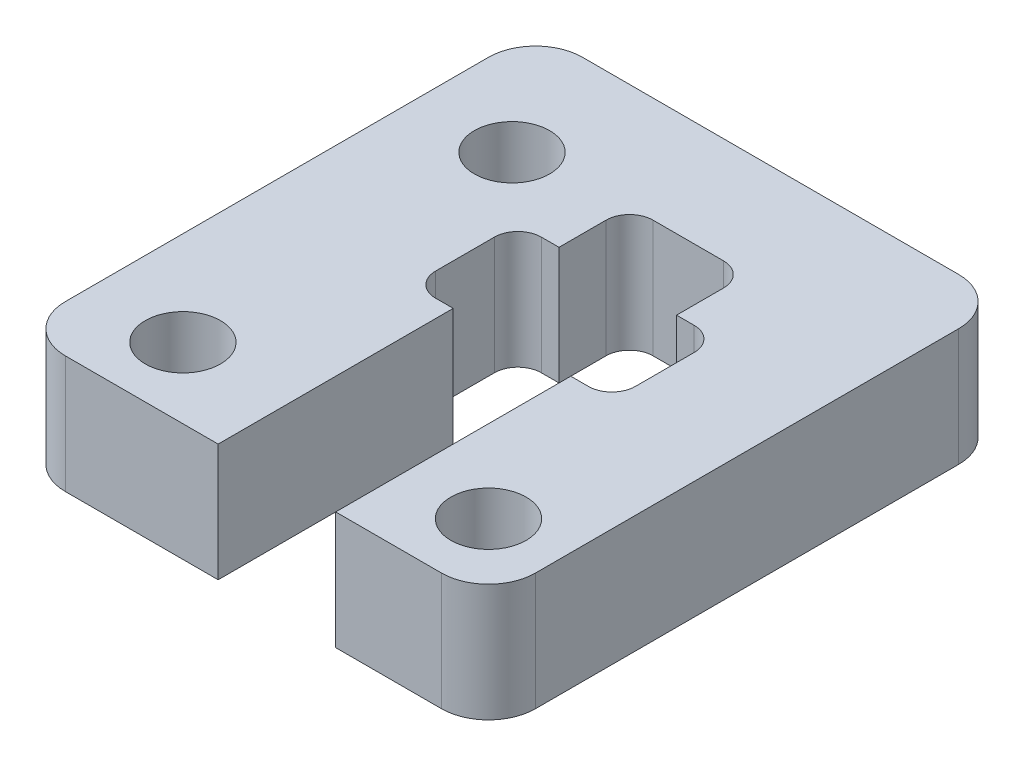
from build123d import *

# Parameters (mm, degrees)
SKETCH_2_W          = 20
SKETCH_2_H          = 22
SKETCH_2_R          = 1.6
SKETCH_2_W_2        = 8.5
SKETCH_2_H_2        = 4.5
EXTRUDE_1_DEPTH     = 5
SKETCH_3_W          = 5
SKETCH_3_H          = 17.5
CUT_EXTRUDE_1_DEPTH = 17.401219467
FILLET_1_R          = 2
FILLET_2_R          = 1


with BuildPart() as part:
    # 草图2 → 凸台-拉伸1 (new body)
    with BuildSketch(Plane(origin=(0, 0, 0), x_dir=(1, 0, 0), z_dir=(0, 1, 0))):
        with Locations((0, 1)):
            Rectangle(SKETCH_2_W, SKETCH_2_H)
        with Locations(Location((-6, -7, 0), (0, 0, 270))):
            Circle(SKETCH_2_R, mode=Mode.SUBTRACT)
        with Locations(Location((7, -7, 0), (0, 0, 270))):
            Circle(SKETCH_2_R, mode=Mode.SUBTRACT)
        with Locations(Location((-6, 7, 0), (0, 0, 270))):
            Circle(SKETCH_2_R, mode=Mode.SUBTRACT)
        with Locations((1, 2.25)):
            Rectangle(SKETCH_2_W_2, SKETCH_2_H_2, mode=Mode.SUBTRACT)
    extrude(amount=EXTRUDE_1_DEPTH)

    # 草图3 → 切除-拉伸1 (cut, through all)
    with BuildSketch(Plane.XZ):
        with Locations((1, 1.25)):
            Rectangle(SKETCH_3_W, SKETCH_3_H)
    extrude(amount=-CUT_EXTRUDE_1_DEPTH, mode=Mode.SUBTRACT)

    # 圆角1
    fillet_1_edges = [part.edges().sort_by_distance(p)[0] for p in [
        (10, 2.5, 10),
        (-10, 2.5, 10),
        (-10, 2.5, -12),
        (10, 2.5, -12),
    ]]
    fillet(fillet_1_edges, radius=FILLET_1_R)

    # 圆角2
    fillet_2_edges = [part.edges().sort_by_distance(p)[0] for p in [
        (5.25, 2.5, -4.5),
        (-3.25, 2.5, -4.5),
        (-3.25, 2.5, 0),
        (5.25, 2.5, 0),
        (-1.5, 2.5, -7.5),
        (3.5, 2.5, -7.5),
    ]]
    fillet(fillet_2_edges, radius=FILLET_2_R)


solid = part.part
